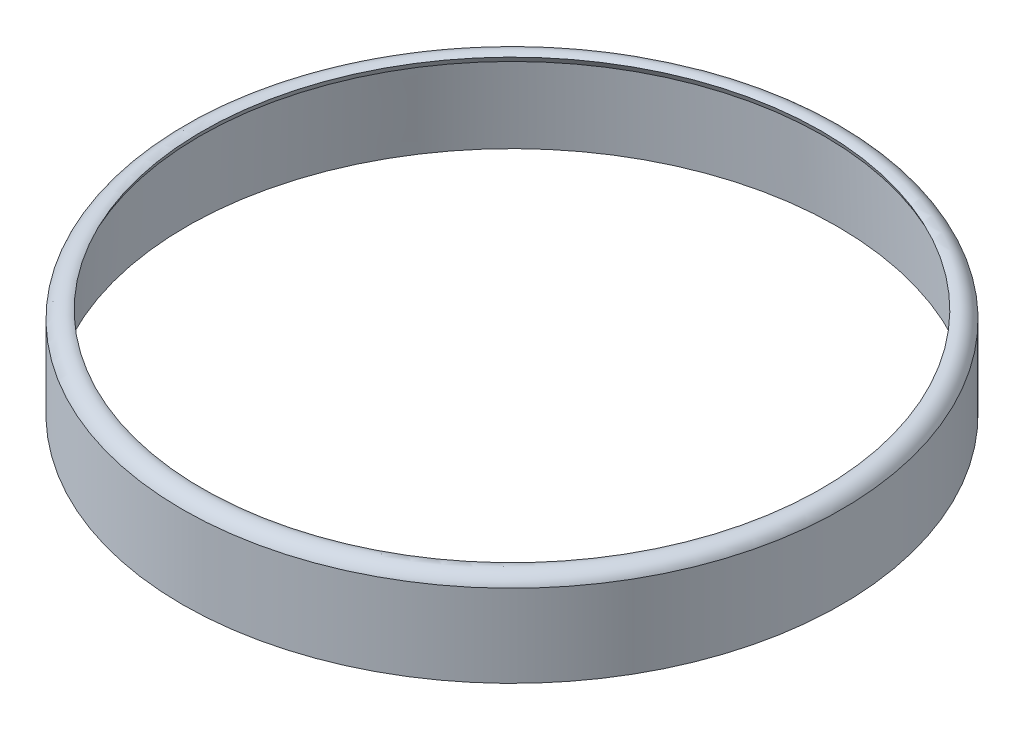
from build123d import *


with BuildPart() as part:
    # Sketch1 → Revolve1 (revolve)
    with BuildSketch(Plane.XY, mode=Mode.PRIVATE) as revolve1_sk:
        with BuildLine():
            Line((-160.000324379, 0), (-160.000324379, 40))
            ThreePointArc((-160.000324379, 40), (-156.008550409, 44.068753886), (-150.310854254, 43.909769197))
            Line((-150.310854254, 43.909769197), (-151.594185817, 41.178973623))
            ThreePointArc((-151.594185817, 41.178973623), (-154.027261377, 40.898020682), (-156.305934256, 40))
            Line((-156.305934256, 40), (-158.000324379, 0))
            Line((-158.000324379, 0), (-160.000324379, 0))
        make_face()
    revolve(revolve1_sk.sketch.rotate(Axis((0, 0, 0), (0, 1, 0)), 270), axis=Axis((0, 0, 0), (0, 1, 0)))


solid = part.part
